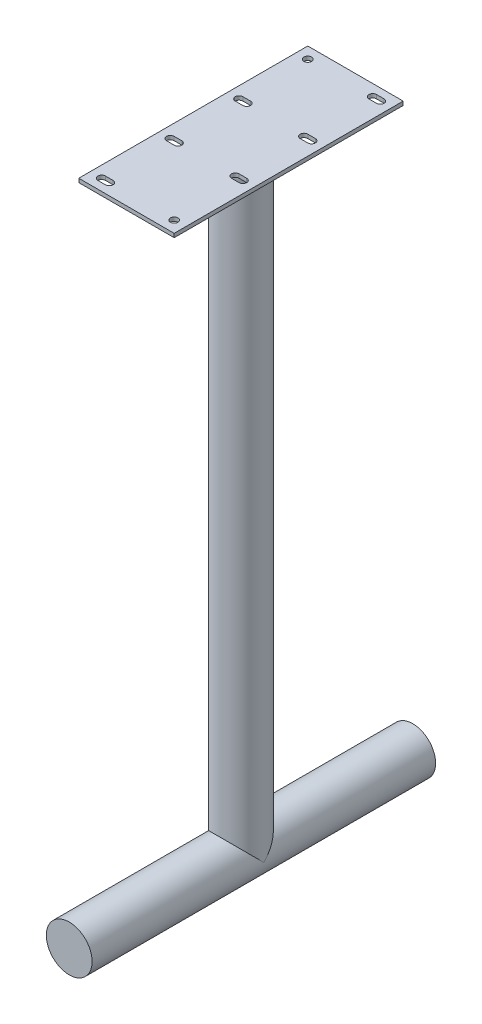
from build123d import *

# Parameters (mm, degrees)
SKETCH1_W           = 125
SKETCH1_H           = 300
SKETCH1_R           = 5
BOSS_EXTRUDE1_DEPTH = 5
SKETCH2_R           = 30
BOSS_EXTRUDE2_DEPTH = 800
SKETCH3_R           = 30
BOSS_EXTRUDE3_DEPTH = 225


with BuildPart() as part:
    # Sketch1 → Boss-Extrude1 (new body)
    with BuildSketch(Plane(origin=(0, 0, 0), x_dir=(1, 0, 0), z_dir=(0, 1, 0))):
        Rectangle(SKETCH1_W, SKETCH1_H)
        with BuildLine():
            ThreePointArc((-47.5, -140), (-52.5, -135), (-47.5, -130))
            Line((-47.5, -130), (-37.5, -130))
            ThreePointArc((-37.5, -130), (-32.5, -135), (-37.5, -140))
            Line((-37.5, -140), (-47.5, -140))
        make_face(mode=Mode.SUBTRACT)
        with BuildLine():
            ThreePointArc((-47.5, -50), (-52.5, -45), (-47.5, -40))
            Line((-47.5, -40), (-37.5, -40))
            ThreePointArc((-37.5, -40), (-32.5, -45), (-37.5, -50))
            Line((-37.5, -50), (-47.5, -50))
        make_face(mode=Mode.SUBTRACT)
        with Locations((47.5, -135)):
            Circle(SKETCH1_R, mode=Mode.SUBTRACT)
        with BuildLine():
            ThreePointArc((47.5, -40), (52.5, -45), (47.5, -50))
            Line((47.5, -50), (37.5, -50))
            ThreePointArc((37.5, -50), (32.5, -45), (37.5, -40))
            Line((37.5, -40), (47.5, -40))
        make_face(mode=Mode.SUBTRACT)
        with BuildLine():
            ThreePointArc((-47.5, 40), (-52.5, 45), (-47.5, 50))
            Line((-47.5, 50), (-37.5, 50))
            ThreePointArc((-37.5, 50), (-32.5, 45), (-37.5, 40))
            Line((-37.5, 40), (-47.5, 40))
        make_face(mode=Mode.SUBTRACT)
        with Locations((-47.5, 135)):
            Circle(SKETCH1_R, mode=Mode.SUBTRACT)
        with BuildLine():
            ThreePointArc((47.5, 50), (52.5, 45), (47.5, 40))
            Line((47.5, 40), (37.5, 40))
            ThreePointArc((37.5, 40), (32.5, 45), (37.5, 50))
            Line((37.5, 50), (47.5, 50))
        make_face(mode=Mode.SUBTRACT)
        with BuildLine():
            ThreePointArc((47.5, 140), (52.5, 135), (47.5, 130))
            Line((47.5, 130), (37.5, 130))
            ThreePointArc((37.5, 130), (32.5, 135), (37.5, 140))
            Line((37.5, 140), (47.5, 140))
        make_face(mode=Mode.SUBTRACT)
    extrude(amount=-BOSS_EXTRUDE1_DEPTH)

    # Sketch2 → Boss-Extrude2 (add)
    with BuildSketch(Plane(origin=(0, -5, 0), x_dir=(-1, 0, 0), z_dir=(0, -1, 0))):
        Circle(SKETCH2_R)
    extrude(amount=BOSS_EXTRUDE2_DEPTH)

    # Sketch3 → Boss-Extrude3 (add, symmetric)
    with BuildSketch(Plane.XY):
        with Locations((0, -805)):
            Circle(SKETCH3_R)
    extrude(amount=BOSS_EXTRUDE3_DEPTH, both=True)


solid = part.part
